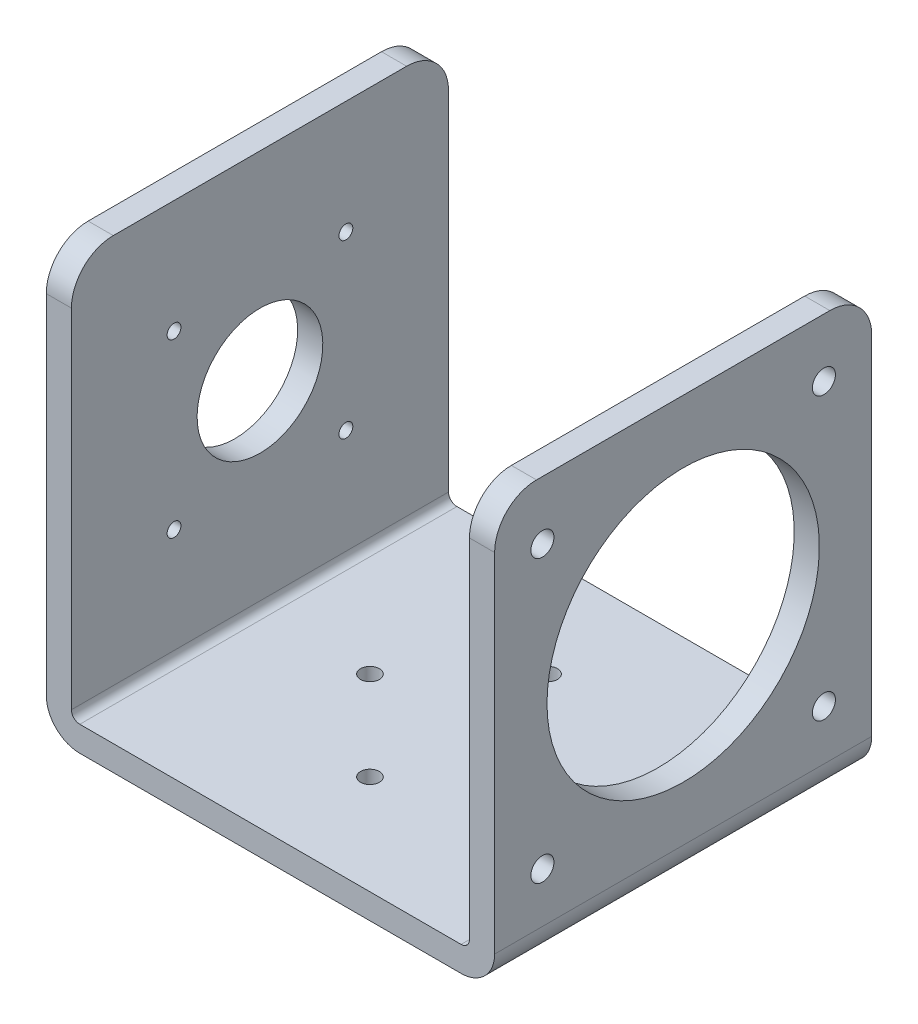
from build123d import *

# Parameters (mm, degrees)
BOSS_EXTRUDE1_DEPTH      = 90
M4_CLEARANCE_HOLE1_D     = 4.5
SKETCH4_R                = 32.5
CUT_EXTRUDE1_DEPTH       = 169.825353546
M5_CLEARANCE_HOLE1_D     = 5.5
M5_CLEARANCE_HOLE1_DEPTH = 6
CUT_EXTRUDE2_REACH       = 174.482
SKETCH7_R                = 15
FILLET1_R                = 8
FILLET2_R                = 2
FILLET3_R                = 10
TAP_DRILL_FOR_M4_TAP1_D  = 3.3


with BuildPart() as part:
    # Sketch1 → Boss-Extrude1 (new body)
    with BuildSketch(Plane.XY):
        Polygon((-53.5, 0), (53.5, 0), (53.5, 101), (47.5, 101), (47.5, 6), (-47.5, 6), (-47.5, 101), (-53.5, 101), align=None)
    extrude(amount=BOSS_EXTRUDE1_DEPTH)

    # M4 Clearance Hole1 (through all)
    with Locations(Plane(origin=(0, 6, 0), x_dir=(1, 0, 0), z_dir=(0, 1, 0))):
        with Locations((-21.25, -45), (0, -23.75), (21.25, -45), (0, -66.25)):
            Hole(M4_CLEARANCE_HOLE1_D / 2)

    # Sketch4 → Cut-Extrude1 (cut, through all)
    with BuildSketch(Plane.ZY.offset(-47.5)):
        with Locations((45, 53.5)):
            Circle(SKETCH4_R)
    extrude(amount=-CUT_EXTRUDE1_DEPTH, mode=Mode.SUBTRACT)

    # M5 Clearance Hole1
    with Locations(Plane(origin=(53.5, 0, 0), x_dir=(0, 0, -1), z_dir=(1, 0, 0))):
        with Locations((-78.587572106, 87.087572106), (-11.412427894, 87.087572106), (-11.412427894, 19.912427894), (-78.587572106, 19.912427894)):
            Hole(M5_CLEARANCE_HOLE1_D / 2, depth=M5_CLEARANCE_HOLE1_DEPTH)

    # Sketch7 → Cut-Extrude2 (cut, up to next)
    with BuildSketch(Plane.ZY.offset(53.5), mode=Mode.PRIVATE) as cut_extrude2_sk1:
        with Locations(Location((45, 53.5, 0), (0, 0, 270))):
            Circle(SKETCH7_R)
    cut_extrude2_tool1 = extrude(cut_extrude2_sk1.sketch, amount=-CUT_EXTRUDE2_REACH, mode=Mode.PRIVATE) & part.part
    add(cut_extrude2_tool1.solids().sort_by_distance((-53.5, 53.5, 45))[0], mode=Mode.SUBTRACT)

    # Fillet1
    fillet1_edges = [part.edges().sort_by_distance(p)[0] for p in [
        (53.5, 0, 45),
        (-53.5, 0, 45),
    ]]
    fillet(fillet1_edges, radius=FILLET1_R)

    # Fillet2
    fillet2_edges = [part.edges().sort_by_distance(p)[0] for p in [
        (-47.5, 6, 45),
        (47.5, 6, 45),
    ]]
    fillet(fillet2_edges, radius=FILLET2_R)

    # Fillet3
    fillet3_edges = [part.edges().sort_by_distance(p)[0] for p in [
        (-50.5, 101, 0),
        (-50.5, 101, 90),
        (50.5, 101, 90),
        (50.5, 101, 0),
    ]]
    fillet(fillet3_edges, radius=FILLET3_R)

    # Tap Drill for M4 Tap1 (through all)
    with Locations(Plane(origin=(-47.5, 0, 0), x_dir=(0, 0, -1), z_dir=(1, 0, 0))):
        with Locations((-65.506096654, 74.006096654), (-24.493903346, 74.006096654), (-24.493903346, 32.993903346), (-65.506096654, 32.993903346)):
            Hole(TAP_DRILL_FOR_M4_TAP1_D / 2)


solid = part.part
